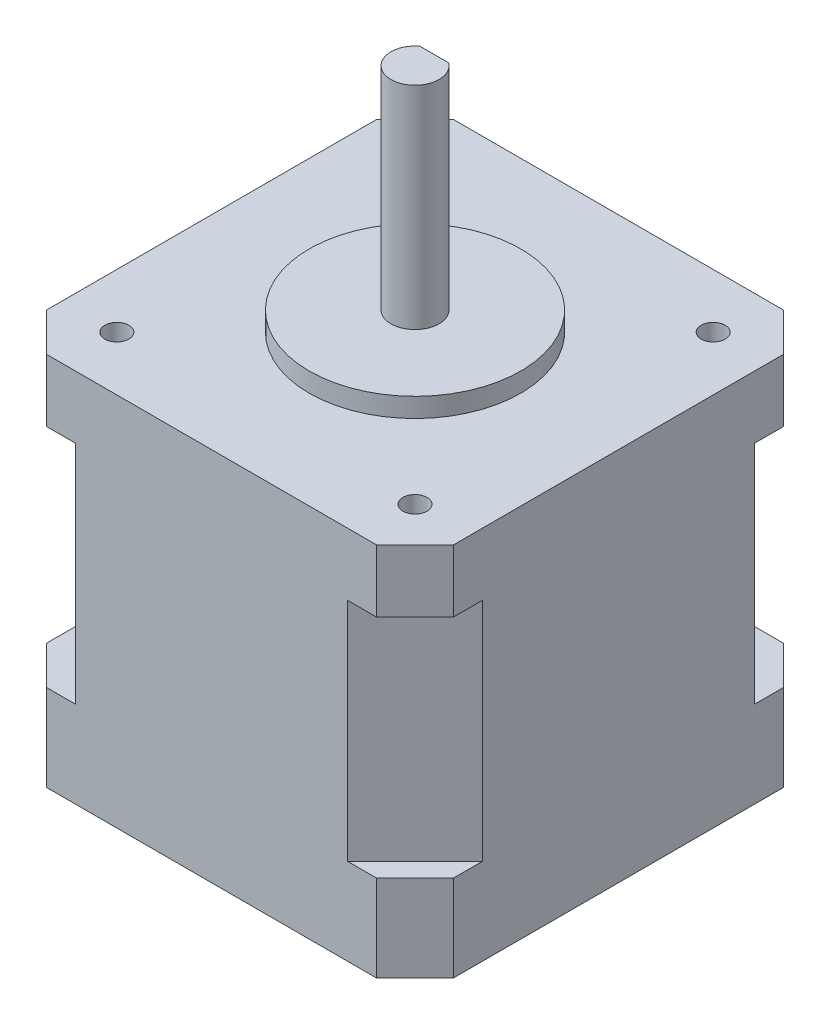
from build123d import *

# Parameters (mm, degrees)
ESQUISSE1_W                                   = 42.3
ESQUISSE1_H                                   = 42.3
BOSS_EXTRU_1_DEPTH                            = 39
ESQUISSE2_R                                   = 11
BOSS_EXTRU_2_DEPTH                            = 2
BOSS_EXTRU_3_DEPTH                            = 22
TROU_POUR_TARAUDAGE_POUR_TROU_TARAUD_M3_D     = 2.5
TROU_POUR_TARAUDAGE_POUR_TROU_TARAUD_M3_DEPTH = 4.048924226
TROU_POUR_TARAUDAGE_POUR_TROU_TARAUD_M3_TIP   = 0.751075774
CHANFREIN1_SIZE                               = 4
ENL_V_START                                   = 9
ENL_V_MAT_EXTRU_1_DEPTH                       = 23.5
ESQUISSE5_R                                   = 0.7
ESQUISSE5_R_2                                 = 0.654723083
BOSS_EXTRU_4_DEPTH                            = 10


with BuildPart() as part:
    # Esquisse1 → Boss.-Extru.1 (new body)
    with BuildSketch(Plane(origin=(0, 0, 0), x_dir=(1, 0, 0), z_dir=(0, 1, 0))):
        Rectangle(ESQUISSE1_W, ESQUISSE1_H)
    extrude(amount=BOSS_EXTRU_1_DEPTH)

    # Esquisse2 → Boss.-Extru.2 (add)
    with BuildSketch(Plane(origin=(0, 39, 0), x_dir=(1, 0, 0), z_dir=(0, 1, 0))):
        with Locations(Location((0, 0, 0), (0, 0, 270))):
            Circle(ESQUISSE2_R)
    extrude(amount=BOSS_EXTRU_2_DEPTH)

    # Esquisse3 → Boss.-Extru.3 (add)
    with BuildSketch(Plane(origin=(0, 41, 0), x_dir=(1, 0, 0), z_dir=(0, 1, 0))):
        with BuildLine():
            Line((-1.5, 2), (1.5, 2))
            ThreePointArc((1.5, 2), (0, -2.5), (-1.5, 2))
        make_face()
    extrude(amount=BOSS_EXTRU_3_DEPTH)

    # Trou pour taraudage pour trou taraudé M31
    with Locations(Plane(origin=(0, 39, 0), x_dir=(1, 0, 0), z_dir=(0, 1, 0))):
        with Locations((-15.5, 15.5), (15.5, 15.5), (15.5, -15.5), (-15.5, -15.5)):
            Hole(TROU_POUR_TARAUDAGE_POUR_TROU_TARAUD_M3_D / 2, depth=TROU_POUR_TARAUDAGE_POUR_TROU_TARAUD_M3_DEPTH)
            with Locations((0, 0, -(TROU_POUR_TARAUDAGE_POUR_TROU_TARAUD_M3_DEPTH + TROU_POUR_TARAUDAGE_POUR_TROU_TARAUD_M3_TIP / 2))):  # 118° drill point
                Cone(0, TROU_POUR_TARAUDAGE_POUR_TROU_TARAUD_M3_D / 2, TROU_POUR_TARAUDAGE_POUR_TROU_TARAUD_M3_TIP, mode=Mode.SUBTRACT)

    # Chanfrein1
    chanfrein1_edges = [part.edges().sort_by_distance(p)[0] for p in [
        (-21.15, 19.5, -21.15),
        (21.15, 19.5, -21.15),
        (21.15, 19.5, 21.15),
        (-21.15, 19.5, 21.15),
    ]]
    chamfer(chanfrein1_edges, length=CHANFREIN1_SIZE)

    # Esquisse4 → Enlèv. mat.-Extru.1 (cut)
    with BuildSketch(Plane(origin=(0, 0, 0), x_dir=(1, 0, 0), z_dir=(0, 1, 0)).offset(ENL_V_START)):
        Polygon((-14.15, 21.15), (-21.15, 14.15), (-21.15, 21.15), align=None)
        Polygon((21.15, 21.15), (14.15, 21.15), (21.15, 14.15), align=None)
        Polygon((14.15, -21.15), (21.15, -14.15), (21.15, -21.15), align=None)
        Polygon((-21.15, -21.15), (-14.15, -21.15), (-21.15, -14.15), align=None)
    extrude(amount=ENL_V_MAT_EXTRU_1_DEPTH, mode=Mode.SUBTRACT)

    # Esquisse5 → Boss.-Extru.4 (add)
    with BuildSketch(Plane.ZY.offset(21.15)):
        with Locations(Location((-1, 7, 0), (0, 0, 180))):
            Circle(ESQUISSE5_R)
        with Locations(Location((-1, 5, 0), (0, 0, 180))):
            Circle(ESQUISSE5_R_2)
        with Locations(Location((1, 5, 0), (0, 0, 180))):
            Circle(ESQUISSE5_R_2)
        with Locations(Location((1, 7, 0), (0, 0, 180))):
            Circle(ESQUISSE5_R)
    extrude(amount=BOSS_EXTRU_4_DEPTH)


solid = part.part
